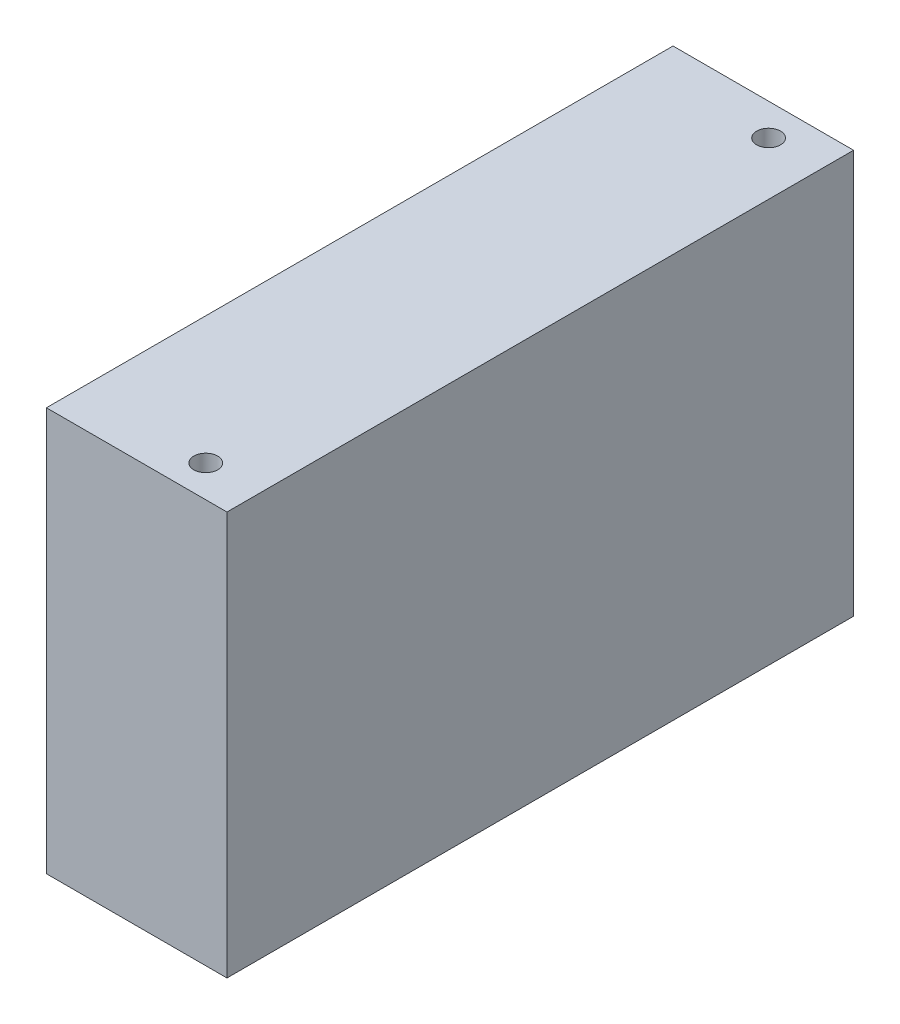
from build123d import *

# Parameters (mm, degrees)
SKETCH_1_W          = 34
SKETCH_1_H          = 118
EXTRUDE_1_DEPTH     = 76
SKETCH_2_R          = 2.25
CUT_EXTRUDE_1_DEPTH = 98.703633505


with BuildPart() as part:
    # 草图1 → 凸台-拉伸1 (new body)
    with BuildSketch(Plane(origin=(0, 0, 0), x_dir=(1, 0, 0), z_dir=(0, 1, 0))):
        Rectangle(SKETCH_1_W, SKETCH_1_H)
    extrude(amount=EXTRUDE_1_DEPTH)

    # 草图2 → 切除-拉伸1 (cut, through all)
    with BuildSketch(Plane.XZ):
        with Locations(Location((7, 53, 0), (0, 0, 270))):
            Circle(SKETCH_2_R)
        with Locations(Location((7, -53, 0), (0, 0, 90))):
            Circle(SKETCH_2_R)
    extrude(amount=-CUT_EXTRUDE_1_DEPTH, mode=Mode.SUBTRACT)


solid = part.part
